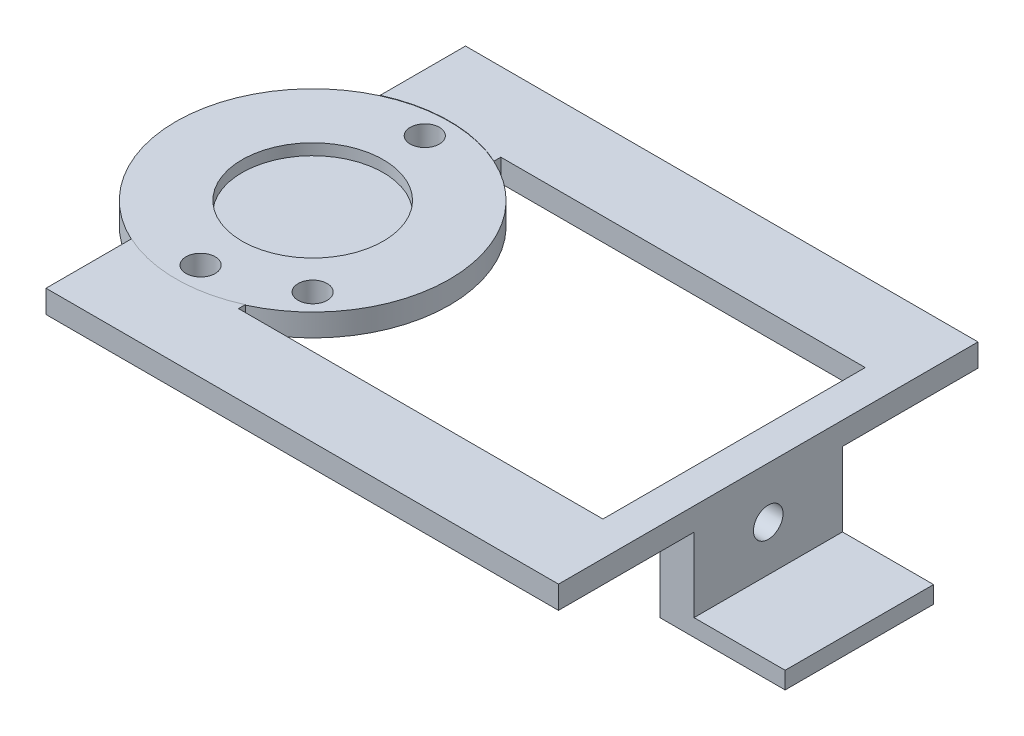
from build123d import *

# Parameters (mm, degrees)
SKETCH1_R            = 30.5
BOSS_EXTRUDE1_DEPTH  = 5
SKETCH2_R            = 15.75
CUT_EXTRUDE1_DEPTH   = 2.5
SKETCH3_R            = 15.75
BOSS_EXTRUDE2_DEPTH  = 2.5
SKETCH4_R            = 3.25
CUT_EXTRUDE2_DEPTH   = 5.08
SKETCH5_R            = 3.25
CUT_EXTRUDE3_DEPTH   = 5.08
SKETCH6_R            = 3.25
CUT_EXTRUDE4_DEPTH   = 5.08
BOSS_EXTRUDE3_DEPTH  = 5.08
BOSS_EXTRUDE4_DEPTH  = 5.08
SKETCH9_W            = 17.526
SKETCH9_H            = 5.08
BOSS_EXTRUDE5_DEPTH  = 106.68
SKETCH10_W           = 17.526
SKETCH10_H           = 5.08
BOSS_EXTRUDE6_DEPTH  = 106.68
SKETCH11_W           = 25.4
SKETCH11_H           = 5.08
BOSS_EXTRUDE8_DEPTH  = 63.5
SKETCH14_W           = 93.56025604
SKETCH14_H           = 5.08
CUT_EXTRUDE6_DEPTH   = 17.78
SKETCH15_W           = 7.62
SKETCH15_H           = 33.10825604
BOSS_EXTRUDE10_DEPTH = 20.32
SKETCH16_W           = 33.10825604
SKETCH16_H           = 3.81
BOSS_EXTRUDE11_DEPTH = 20.32
CUT_EXTRUDE7_DEPTH   = 7.62
SKETCH18_R           = 4.826
CUT_EXTRUDE8_DEPTH   = 2.54


with BuildPart() as part:
    # Sketch1 → Boss-Extrude1 (new body)
    with BuildSketch(Plane(origin=(0, 0, 0), x_dir=(1, 0, 0), z_dir=(0, 1, 0))):
        with Locations(Location((0, 0, 0), (0, 0, 270))):
            Circle(SKETCH1_R)
    extrude(amount=BOSS_EXTRUDE1_DEPTH)

    # Sketch2 → Cut-Extrude1 (cut)
    with BuildSketch(Plane(origin=(0, 5, 0), x_dir=(1, 0, 0), z_dir=(0, 1, 0))):
        with Locations(Location((0, 0, 0), (0, 0, 270))):
            Circle(SKETCH2_R)
    extrude(amount=-CUT_EXTRUDE1_DEPTH, mode=Mode.SUBTRACT)

    # Sketch3 → Boss-Extrude2 (add)
    with BuildSketch(Plane.XZ):
        with Locations(Location((0, 0, 0), (0, 0, 90))):
            Circle(SKETCH3_R)
    extrude(amount=BOSS_EXTRUDE2_DEPTH)

    # Sketch4 → Cut-Extrude2 (cut)
    with BuildSketch(Plane(origin=(0, 0, 0), x_dir=(-1, 0, 0), z_dir=(0, -1, 0))):
        with Locations(Location((0, 25, 0), (0, 0, 90))):
            Circle(SKETCH4_R)
    extrude(amount=-CUT_EXTRUDE2_DEPTH, mode=Mode.SUBTRACT)

    # Sketch5 → Cut-Extrude3 (cut)
    with BuildSketch(Plane.XZ):
        with Locations(Location((0, 25, 0), (0, 0, 270))):
            Circle(SKETCH5_R)
    extrude(amount=-CUT_EXTRUDE3_DEPTH, mode=Mode.SUBTRACT)

    # Sketch6 → Cut-Extrude4 (cut)
    with BuildSketch(Plane.XZ):
        with Locations(Location((17.674476483, 17.680862, 0), (0, 0, 270))):
            Circle(SKETCH6_R)
    extrude(amount=-CUT_EXTRUDE4_DEPTH, mode=Mode.SUBTRACT)

    # Sketch7 → Boss-Extrude3 (add)
    with BuildSketch(Plane(origin=(0, 0, 0), x_dir=(-1, 0, 0), z_dir=(0, -1, 0))):
        with BuildLine():
            ThreePointArc((12.7, -27.73012802), (6.499272859, -29.79948745), (0, -30.5))
            ThreePointArc((0, -30.5), (-6.499272859, -29.79948745), (-12.7, -27.73012802))
            Line((-12.7, -27.73012802), (-12.7, -46.78012802))
            Line((-12.7, -46.78012802), (12.7, -46.78012802))
            Line((12.7, -46.78012802), (12.7, -27.73012802))
        make_face()
    extrude(amount=-BOSS_EXTRUDE3_DEPTH)

    # Sketch8 → Boss-Extrude4 (add)
    with BuildSketch(Plane.XZ):
        with BuildLine():
            ThreePointArc((0, -30.5), (-6.499272859, -29.79948745), (-12.7, -27.73012802))
            Line((-12.7, -27.73012802), (-12.7, -46.78012802))
            Line((-12.7, -46.78012802), (12.7, -46.78012802))
            Line((12.7, -46.78012802), (12.7, -27.73012802))
            ThreePointArc((12.7, -27.73012802), (6.499272859, -29.79948745), (0, -30.5))
        make_face()
    extrude(amount=-BOSS_EXTRUDE4_DEPTH)

    # Sketch9 → Boss-Extrude5 (add)
    with BuildSketch(Plane(origin=(12.7, 0, 0), x_dir=(0, 0, -1), z_dir=(1, 0, 0))):
        with Locations((38.01712802, 2.54)):
            Rectangle(SKETCH9_W, SKETCH9_H)
    extrude(amount=BOSS_EXTRUDE5_DEPTH)

    # Sketch10 → Boss-Extrude6 (add)
    with BuildSketch(Plane(origin=(12.7, 0, 0), x_dir=(0, 0, -1), z_dir=(1, 0, 0))):
        with Locations((-38.01712802, 2.54)):
            Rectangle(SKETCH10_W, SKETCH10_H)
    extrude(amount=BOSS_EXTRUDE6_DEPTH)

    # Sketch11 → Boss-Extrude8 (add)
    with BuildSketch(Plane(origin=(0, 0, 29.25412802), x_dir=(-1, 0, 0), z_dir=(0, 0, -1))):
        with Locations((-106.68, 2.54)):
            Rectangle(SKETCH11_W, SKETCH11_H)
    extrude(amount=BOSS_EXTRUDE8_DEPTH)

    # Sketch14 → Cut-Extrude6 (cut)
    with BuildSketch(Plane(origin=(119.38, 0, 0), x_dir=(0, 0, -1), z_dir=(1, 0, 0))):
        with Locations((0, 2.54)):
            Rectangle(SKETCH14_W, SKETCH14_H)
    extrude(amount=-CUT_EXTRUDE6_DEPTH, mode=Mode.SUBTRACT)

    # Sketch15 → Boss-Extrude10 (add)
    with BuildSketch(Plane.XZ):
        with Locations((97.79, 0)):
            Rectangle(SKETCH15_W, SKETCH15_H)
    extrude(amount=BOSS_EXTRUDE10_DEPTH)

    # Sketch16 → Boss-Extrude11 (add)
    with BuildSketch(Plane(origin=(101.6, 0, 0), x_dir=(0, 0, -1), z_dir=(1, 0, 0))):
        with Locations((0, -18.415)):
            Rectangle(SKETCH16_W, SKETCH16_H)
    extrude(amount=BOSS_EXTRUDE11_DEPTH)

    # Sketch17 → Cut-Extrude7 (cut)
    with BuildSketch(Plane.ZY.offset(-93.98)):
        with BuildLine():
            ThreePointArc((0, -3.048), (-3.302, -6.35), (0, -9.652))
            Line((0, -9.652), (0, -3.048))
        make_face()
        with BuildLine():
            Line((0, -3.048), (0, -9.652))
            ThreePointArc((0, -9.652), (2.334866591, -8.684866591), (3.302, -6.35))
            ThreePointArc((3.302, -6.35), (2.334866591, -4.015133409), (0, -3.048))
        make_face()
    extrude(amount=-CUT_EXTRUDE7_DEPTH, mode=Mode.SUBTRACT)

    # Sketch18 → Cut-Extrude8 (cut)
    with BuildSketch(Plane.ZY.offset(-93.98)):
        with Locations((0, -6.35)):
            Circle(SKETCH18_R)
    extrude(amount=-CUT_EXTRUDE8_DEPTH, mode=Mode.SUBTRACT)


solid = part.part
